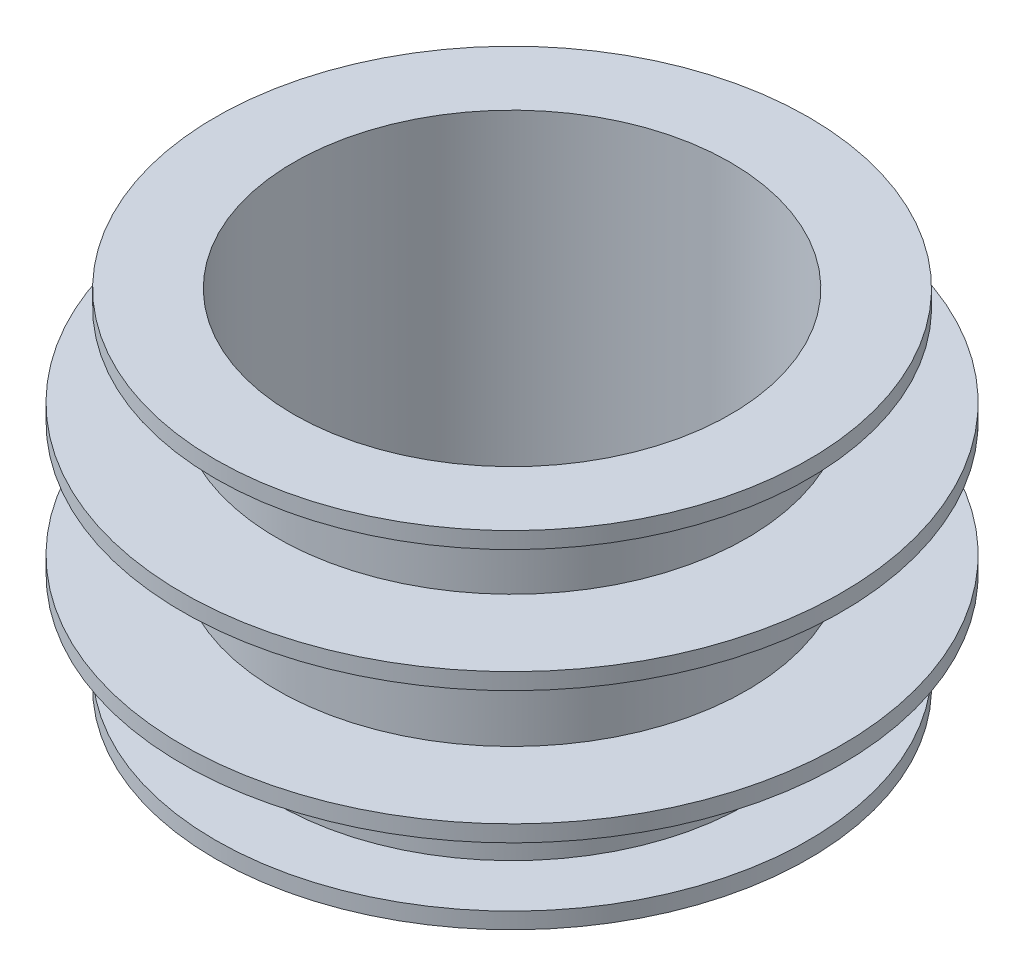
from build123d import *

# Parameters (mm, degrees)
SKETCH_2_R          = 13.25
CUT_EXTRUDE_1_DEPTH = 36.215875749


with BuildPart() as part:
    # 草图1 → 旋转1 (revolve)
    with BuildSketch(Plane.XY, mode=Mode.PRIVATE) as revolve_1_sk:
        Polygon((11.881076893, 20.979940533), (18, 20.979940533), (18, 19.979940533), (14.25, 19.979940533), (14.25, 14.979940533), (20, 14.979940533), (20, 13.979940533), (14.25, 13.979940533), (14.25, 6.979940533), (20, 6.979940533), (20, 5.979940533), (14.25, 5.979940533), (14.25, 0.979940533), (18, 0.979940533), (18, 0), (4.648229123, 0), (0, 0), (0, 20.979940533), align=None)
    revolve(revolve_1_sk.sketch.rotate(Axis((0, 0, 0), (0, 1, 0)), 90), axis=Axis((0, 0, 0), (0, 1, 0)))

    # 草图2 → 切除-拉伸1 (cut, through all)
    with BuildSketch(Plane(origin=(0, 20.979940533, 0), x_dir=(1, 0, 0), z_dir=(0, 1, 0))):
        with Locations(Location((0, 0, 0), (0, 0, 270))):
            Circle(SKETCH_2_R)
    extrude(amount=-CUT_EXTRUDE_1_DEPTH, mode=Mode.SUBTRACT)


solid = part.part
